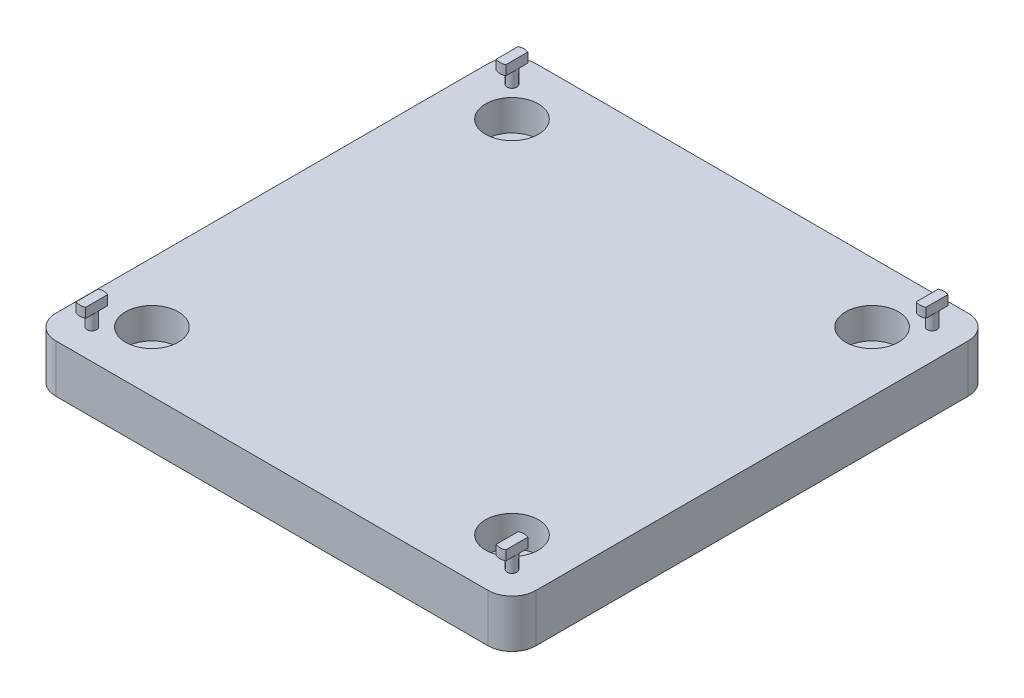
from build123d import *

# Parameters (mm, degrees)
SKETCH1_W                                           = 100
SKETCH1_H                                           = 100
BOSS_EXTRUDE1_DEPTH                                 = 10
CBORE_FOR_M6_HEX_SOCKET_HEAD_CAP_SCREW1_D           = 7
CBORE_FOR_M6_HEX_SOCKET_HEAD_CAP_SCREW1_DEPTH       = 17.946987833
CBORE_FOR_M6_HEX_SOCKET_HEAD_CAP_SCREW1_CBORE_D     = 11
CBORE_FOR_M6_HEX_SOCKET_HEAD_CAP_SCREW1_CBORE_DEPTH = 6.4
CBORE_FOR_M6_HEX_SOCKET_HEAD_CAP_SCREW1_TIP         = 2.103012167
FILLET1_R                                           = 5
SKETCH4_R                                           = 1
BOSS_EXTRUDE2_DEPTH                                 = 3.2
SKETCH5_R                                           = 2.5
BOSS_EXTRUDE3_DEPTH                                 = 2
CUT_EXTRUDE1_START                                  = -3
CUT_EXTRUDE1_DEPTH                                  = 3
LPATTERN1_COUNT                                     = 2
LPATTERN1_PITCH                                     = 87.5
LPATTERN1_COUNT_DIR2                                = 2
LPATTERN1_PITCH_DIR2                                = 87.5


with BuildPart() as part:
    # Sketch1 → Boss-Extrude1 (new body)
    with BuildSketch(Plane(origin=(0, 0, 0), x_dir=(1, 0, 0), z_dir=(0, 1, 0))):
        Rectangle(SKETCH1_W, SKETCH1_H)
    extrude(amount=BOSS_EXTRUDE1_DEPTH)

    # CBORE for M6 Hex Socket Head Cap Screw1
    with Locations(Plane(origin=(0, 10, 0), x_dir=(1, 0, 0), z_dir=(0, 1, 0))):
        with Locations((-37.5, -37.5), (37.5, -37.5), (37.5, 37.5), (-37.5, 37.5)):
            CounterBoreHole(CBORE_FOR_M6_HEX_SOCKET_HEAD_CAP_SCREW1_D / 2, CBORE_FOR_M6_HEX_SOCKET_HEAD_CAP_SCREW1_CBORE_D / 2, CBORE_FOR_M6_HEX_SOCKET_HEAD_CAP_SCREW1_CBORE_DEPTH, depth=CBORE_FOR_M6_HEX_SOCKET_HEAD_CAP_SCREW1_DEPTH)
            with Locations((0, 0, -(CBORE_FOR_M6_HEX_SOCKET_HEAD_CAP_SCREW1_DEPTH + CBORE_FOR_M6_HEX_SOCKET_HEAD_CAP_SCREW1_TIP / 2))):  # 118° drill point
                Cone(0, CBORE_FOR_M6_HEX_SOCKET_HEAD_CAP_SCREW1_D / 2, CBORE_FOR_M6_HEX_SOCKET_HEAD_CAP_SCREW1_TIP, mode=Mode.SUBTRACT)

    # Fillet1
    fillet1_edges = [part.edges().sort_by_distance(p)[0] for p in [
        (50, 5, 50),
        (-50, 5, 50),
        (-50, 5, -50),
        (50, 5, -50),
    ]]
    fillet(fillet1_edges, radius=FILLET1_R)

    # Sketch4 → Boss-Extrude2 (add)
    with BuildSketch(Plane(origin=(0, 10, 0), x_dir=(1, 0, 0), z_dir=(0, 1, 0))):
        with Locations(Location((-43.75, 43.75, 0), (0, 0, 270))):
            Circle(SKETCH4_R)
        with Locations(Location((43.75, 43.75, 0), (0, 0, 270))):
            Circle(SKETCH4_R)
        with Locations(Location((-43.75, -43.75, 0), (0, 0, 270))):
            Circle(SKETCH4_R)
        with Locations(Location((43.75, -43.75, 0), (0, 0, 270))):
            Circle(SKETCH4_R)
    extrude(amount=BOSS_EXTRUDE2_DEPTH)

    # Sketch5 → Boss-Extrude3 (add)
    with BuildSketch(Plane(origin=(0, 13.2, 0), x_dir=(1, 0, 0), z_dir=(0, 1, 0))):
        with Locations(Location((-43.75, 43.75, 0), (0, 0, 270))):
            Circle(SKETCH5_R)
        with Locations(Location((43.75, 43.75, 0), (0, 0, 270))):
            Circle(SKETCH5_R)
        with Locations(Location((43.75, -43.75, 0), (0, 0, 270))):
            Circle(SKETCH5_R)
        with Locations(Location((-43.75, -43.75, 0), (0, 0, 270))):
            Circle(SKETCH5_R)
    extrude(amount=BOSS_EXTRUDE3_DEPTH)

    # Sketch6 → Cut-Extrude1 (cut)
    with BuildSketch(Plane(origin=(0, 15.2, 0), x_dir=(1, 0, 0), z_dir=(0, 1, 0)).offset(CUT_EXTRUDE1_START)):
        with BuildLine():
            ThreePointArc((-44.75, 46.041287847), (-46.25, 43.75), (-44.75, 41.458712153))
            Line((-44.75, 41.458712153), (-44.75, 46.041287847))
        make_face()
        with BuildLine():
            Line((-42.75, 46.041287847), (-42.75, 41.458712153))
            ThreePointArc((-42.75, 41.458712153), (-41.658349934, 42.380693606), (-41.25, 43.75))
            ThreePointArc((-41.25, 43.75), (-41.658349934, 45.119306394), (-42.75, 46.041287847))
        make_face()
    cut_extrude1 = extrude(amount=CUT_EXTRUDE1_DEPTH, mode=Mode.SUBTRACT)

    # LPattern1: Cut-Extrude1 2 × 2
    with Locations(*[(j * LPATTERN1_PITCH_DIR2, 0, i * LPATTERN1_PITCH) for i in range(LPATTERN1_COUNT) for j in range(LPATTERN1_COUNT_DIR2) if (i, j) != (0, 0)]):
        add(cut_extrude1, mode=Mode.SUBTRACT)


solid = part.part
